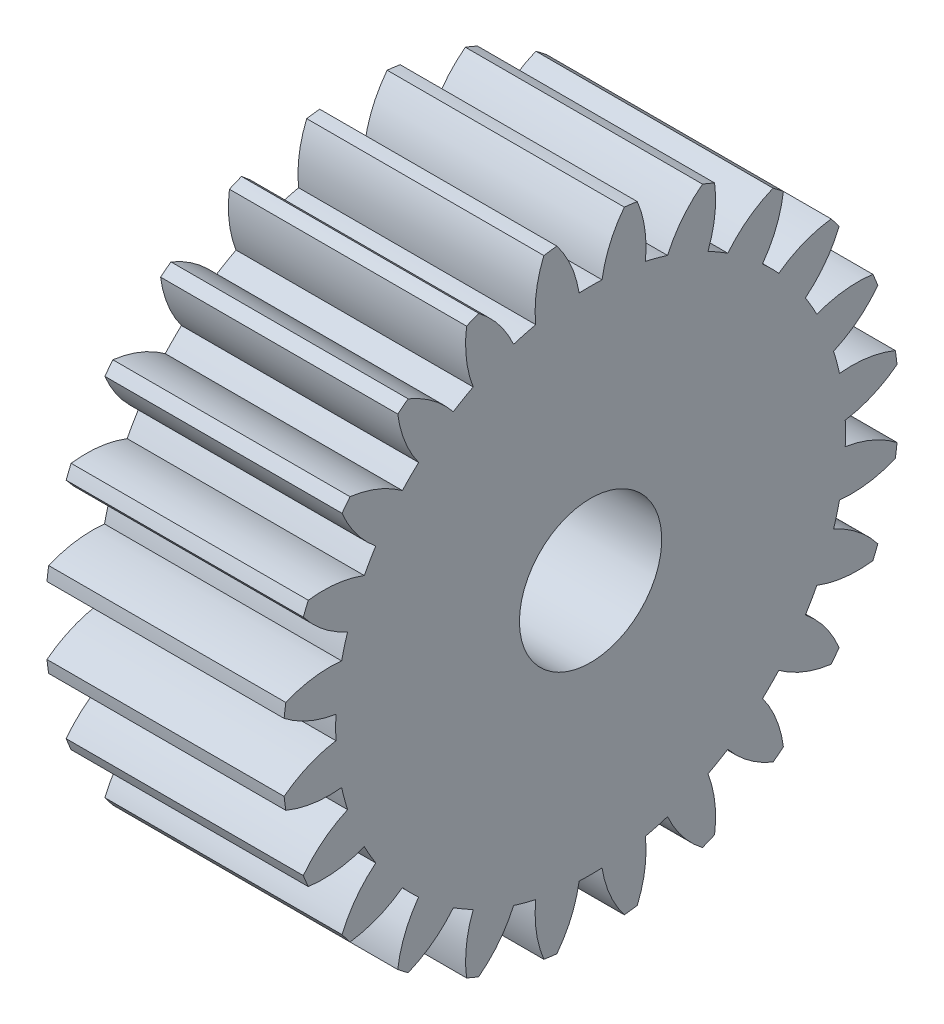
from build123d import *

# Parameters (mm, degrees)
BASPROSKE_W     = 5
BASPROSKE_H     = 6.5
TOOTHCUT_DEPTH  = 11.464224768
TEETHCUTS_COUNT = 24
TEETHCUTS_ANGLE = 345
BORSKE_R        = 1.5
BORE_DEPTH      = 50.0001016


with BuildPart() as part:
    # BasProSke → Base-Revolve (revolve)
    with BuildSketch(Plane(origin=(0, 0, 0), x_dir=(1, 0, 0), z_dir=(0, 1, 0)), mode=Mode.PRIVATE) as base_revolve_sk:
        with Locations((2.5, 3.25)):
            Rectangle(BASPROSKE_W, BASPROSKE_H)
    revolve(base_revolve_sk.sketch.rotate(Axis((-10, 0, 0), (1, 0, 0)), 180), axis=Axis((-10, 0, 0), (1, 0, 0)))

    # TooCutSke → ToothCut (cut, through all)
    with BuildSketch(Plane(origin=(0, 0, 0), x_dir=(0, 0, -1), z_dir=(1, 0, 0))):
        with BuildLine():
            ThreePointArc((0.241646108, 5.368564348), (0, 5.374), (-0.241646108, 5.368564348))
            ThreePointArc((-0.241646108, 5.368564348), (-0.413699957, 5.957993365), (-0.729686037, 6.48447403))
            ThreePointArc((-0.729686037, 6.48447403), (0, 6.5254), (0.729686037, 6.48447403))
            ThreePointArc((0.729686037, 6.48447403), (0.413699957, 5.957993365), (0.241646108, 5.368564348))
        make_face()
    toothcut = extrude(amount=TOOTHCUT_DEPTH, mode=Mode.SUBTRACT)

    # TeethCuts: ToothCut ×24 about axis
    teethcuts_axis = Axis((-10, 0, 0), (1, 0, 0))
    for i in range(1, TEETHCUTS_COUNT):
        add(toothcut.rotate(teethcuts_axis, i * TEETHCUTS_ANGLE / (TEETHCUTS_COUNT - 1)), mode=Mode.SUBTRACT)

    # BorSke → Bore (cut, symmetric)
    with BuildSketch(Plane(origin=(0, 0, 0), x_dir=(0, 0, -1), z_dir=(1, 0, 0))):
        with Locations(Location((0, 0, 0), (0, 0, 180))):
            Circle(BORSKE_R)
    extrude(amount=BORE_DEPTH, both=True, mode=Mode.SUBTRACT)


solid = part.part
